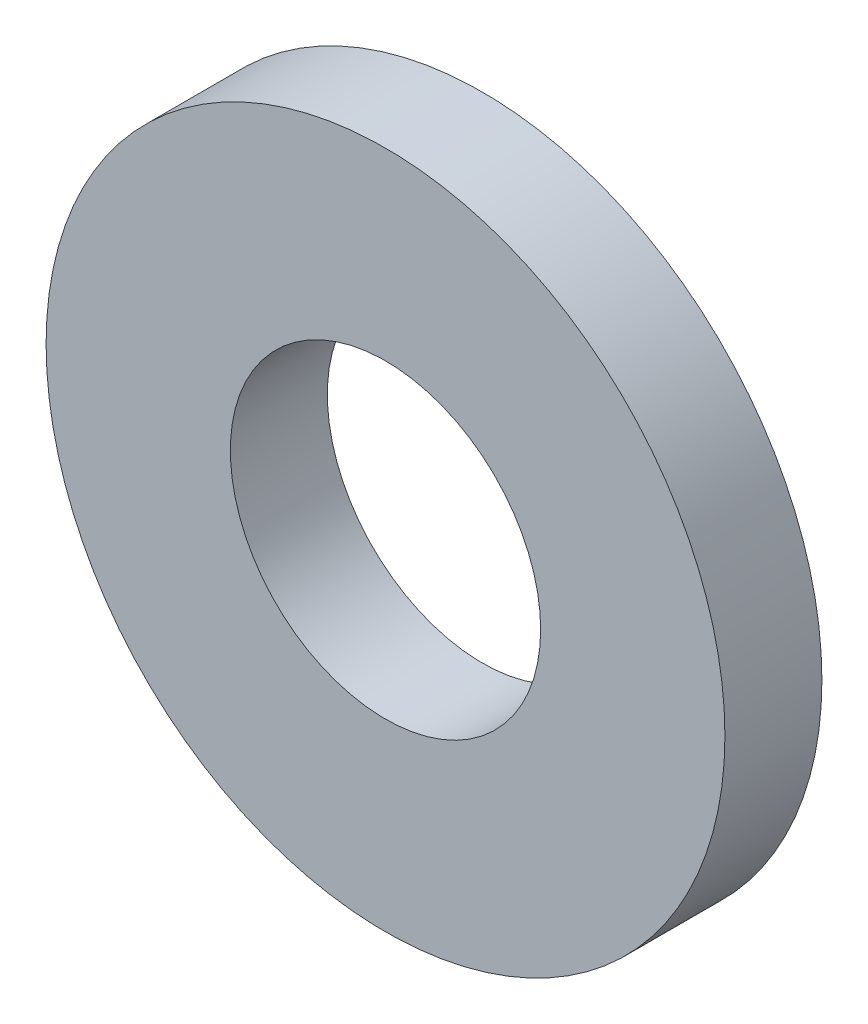
from build123d import *

# Parameters (mm, degrees)
SKETCH_1_R      = 3.5
SKETCH_1_R_2    = 1.6
EXTRUDE_1_DEPTH = 1


with BuildPart() as part:
    # ｽｹｯﾁ1 → ﾎﾞｽ - 押し出し1 (new body)
    with BuildSketch(Plane.XY):
        Circle(SKETCH_1_R)
        Circle(SKETCH_1_R_2, mode=Mode.SUBTRACT)
    extrude(amount=EXTRUDE_1_DEPTH)


solid = part.part
